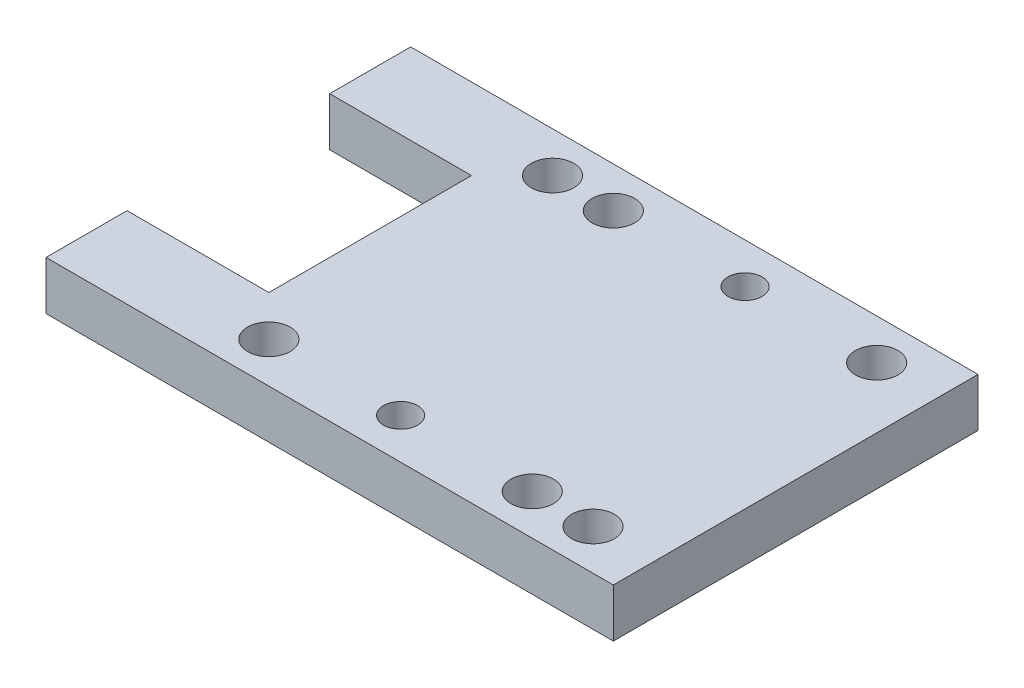
from build123d import *

# Parameters (mm, degrees)
SKETCH1_W                    = 140
SKETCH1_H                    = 90
BOSS_EXTRUDE1_DEPTH          = 12
CUT_EXTRUDE1_REACH           = 86.077
SKETCH2_W                    = 35
SKETCH2_H                    = 50
M10_CLEARANCE_HOLE1_D        = 10.5
F_10_5_10_5_DIAMETER_HOLE1_D = 10.5
M8_TAPPED_HOLE1_D            = 6.8
M8_TAPPED_HOLE1_DEPTH        = 20.207073895
M8_TAPPED_HOLE1_TIP          = 2.042926105
M8_CLEARANCE_HOLE1_D         = 8.4


with BuildPart() as part:
    # Sketch1 → Boss-Extrude1 (new body)
    with BuildSketch(Plane(origin=(0, 0, 0), x_dir=(1, 0, 0), z_dir=(0, 1, 0))):
        Rectangle(SKETCH1_W, SKETCH1_H)
    extrude(amount=-BOSS_EXTRUDE1_DEPTH)

    # Sketch2 → Cut-Extrude1 (cut, up to next)
    with BuildSketch(Plane(origin=(0, 0, 0), x_dir=(1, 0, 0), z_dir=(0, 1, 0)), mode=Mode.PRIVATE) as cut_extrude1_sk1:
        with Locations((-52.5, 0)):
            Rectangle(SKETCH2_W, SKETCH2_H)
    cut_extrude1_tool1 = extrude(cut_extrude1_sk1.sketch, amount=-CUT_EXTRUDE1_REACH, mode=Mode.PRIVATE) & part.part
    add(cut_extrude1_tool1.solids().sort_by_distance((-52.5, 0, 0))[0], mode=Mode.SUBTRACT)

    # M10 Clearance Hole1 (through all)
    with Locations(Plane(origin=(0, 0, 0), x_dir=(1, 0, 0), z_dir=(0, 1, 0))):
        with Locations((-10, 35), (55, 35), (40, -35), (-25, -35)):
            Hole(M10_CLEARANCE_HOLE1_D / 2)

    # Ø10.5 (10.5) Diameter Hole1 (through all)
    with Locations(Plane(origin=(0, 0, 0), x_dir=(1, 0, 0), z_dir=(0, 1, 0))):
        with Locations((-25, 35), (55, -35)):
            Hole(F_10_5_10_5_DIAMETER_HOLE1_D / 2)

    # M8 Tapped Hole1
    with Locations(Plane.ZY.offset(70)):
        with Locations((35, -6), (-35, -6)):
            Hole(M8_TAPPED_HOLE1_D / 2, depth=M8_TAPPED_HOLE1_DEPTH)
            with Locations((0, 0, -(M8_TAPPED_HOLE1_DEPTH + M8_TAPPED_HOLE1_TIP / 2))):  # 118° drill point
                Cone(0, M8_TAPPED_HOLE1_D / 2, M8_TAPPED_HOLE1_TIP, mode=Mode.SUBTRACT)

    # M8 Clearance Hole1 (through all)
    with Locations(Plane(origin=(0, 0, 0), x_dir=(1, 0, 0), z_dir=(0, 1, 0))):
        with Locations((22.5, 35), (7.5, -35)):
            Hole(M8_CLEARANCE_HOLE1_D / 2)


solid = part.part
